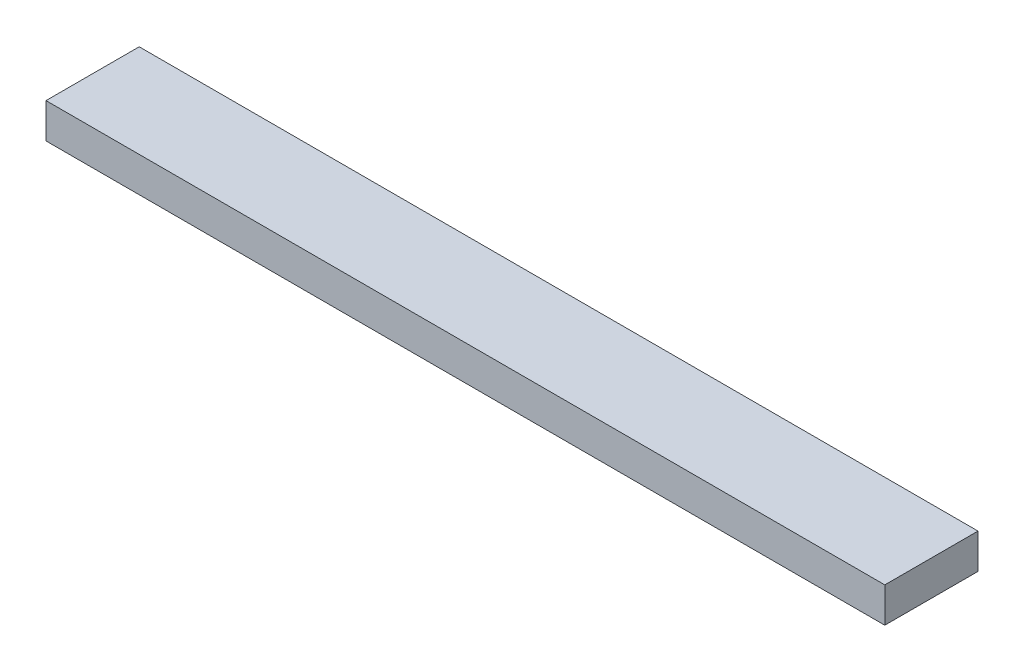
from build123d import *

# Parameters (mm, degrees)
SKETCH1_W           = 457.2
SKETCH1_H           = 50.8
BOSS_EXTRUDE1_DEPTH = 19.05


with BuildPart() as part:
    # Sketch1 → Boss-Extrude1 (new body)
    with BuildSketch(Plane(origin=(0, 0, 0), x_dir=(1, 0, 0), z_dir=(0, 1, 0))):
        Rectangle(SKETCH1_W, SKETCH1_H)
    extrude(amount=BOSS_EXTRUDE1_DEPTH)


solid = part.part
